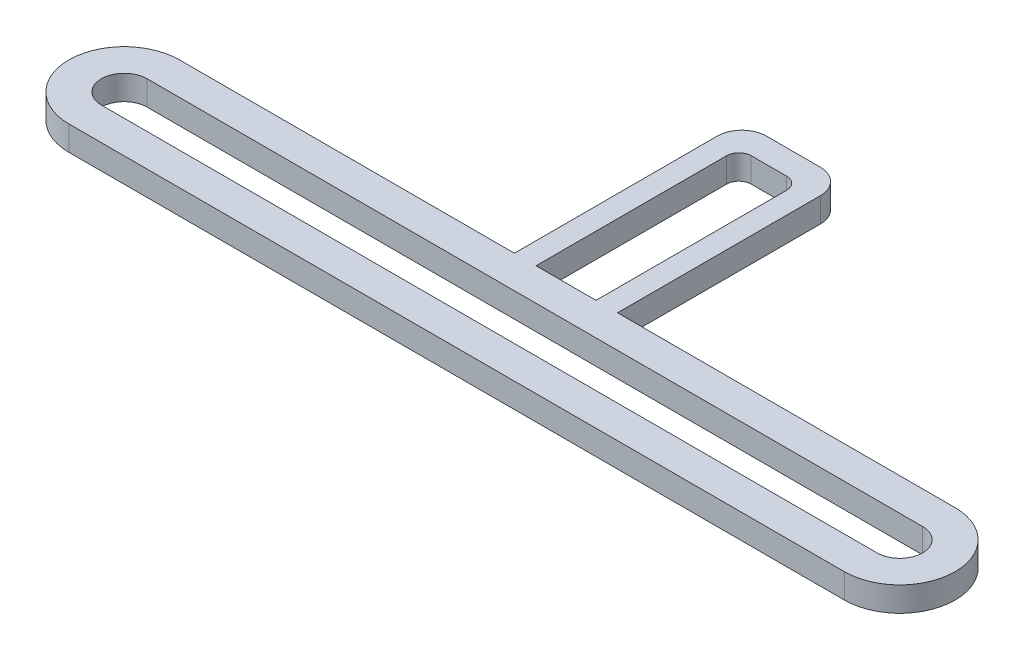
from build123d import *

# Parameters (mm, degrees)
BOSS_EXTRUDE10_DEPTH = 2.54


with BuildPart() as part:
    # Sketch1 → Boss-Extrude10 (new body)
    with BuildSketch(Plane(origin=(0, 0, 0), x_dir=(1, 0, 0), z_dir=(0, 1, 0))):
        with BuildLine():
            Line((-31.894408547, 18.754690562), (2.663348376, 18.754690562))
            Line((2.663348376, 18.754690562), (2.663348376, 39.692958523))
            ThreePointArc((2.663348376, 39.692958523), (3.407297152, 41.489009748), (5.203348376, 42.232958523))
            Line((5.203348376, 42.232958523), (10.77185219, 42.232958523))
            ThreePointArc((10.77185219, 42.232958523), (12.567903415, 41.489009748), (13.31185219, 39.692958523))
            Line((13.31185219, 39.692958523), (13.31185219, 18.754690562))
            Line((13.31185219, 18.754690562), (48.163481181, 18.754690562))
            ThreePointArc((48.163481181, 18.754690562), (53.88203624, 13.036135503), (48.163481181, 7.317580443))
            Line((48.163481181, 7.317580443), (-31.894408547, 7.317580443))
            ThreePointArc((-31.894408547, 7.317580443), (-37.612963606, 13.036135503), (-31.894408547, 18.754690562))
        make_face()
        with BuildLine():
            Line((-31.894408547, 15.393785396), (48.163481181, 15.393785396))
            ThreePointArc((48.163481181, 15.393785396), (50.521131074, 13.036135503), (48.163481181, 10.67848561))
            Line((48.163481181, 10.67848561), (-31.894408547, 10.67848561))
            ThreePointArc((-31.894408547, 10.67848561), (-34.252058439, 13.036135503), (-31.894408547, 15.393785396))
        make_face(mode=Mode.SUBTRACT)
        with BuildLine():
            Line((4.901566165, 18.754690562), (11.086684478, 18.754690562))
            Line((11.086684478, 18.754690562), (11.086684478, 38.422958523))
            ThreePointArc((11.086684478, 38.422958523), (10.71471009, 39.320984135), (9.816684478, 39.692958523))
            Line((9.816684478, 39.692958523), (6.171566165, 39.692958523))
            ThreePointArc((6.171566165, 39.692958523), (5.273540553, 39.320984135), (4.901566165, 38.422958523))
            Line((4.901566165, 38.422958523), (4.901566165, 18.754690562))
        make_face(mode=Mode.SUBTRACT)
    extrude(amount=BOSS_EXTRUDE10_DEPTH)


solid = part.part
